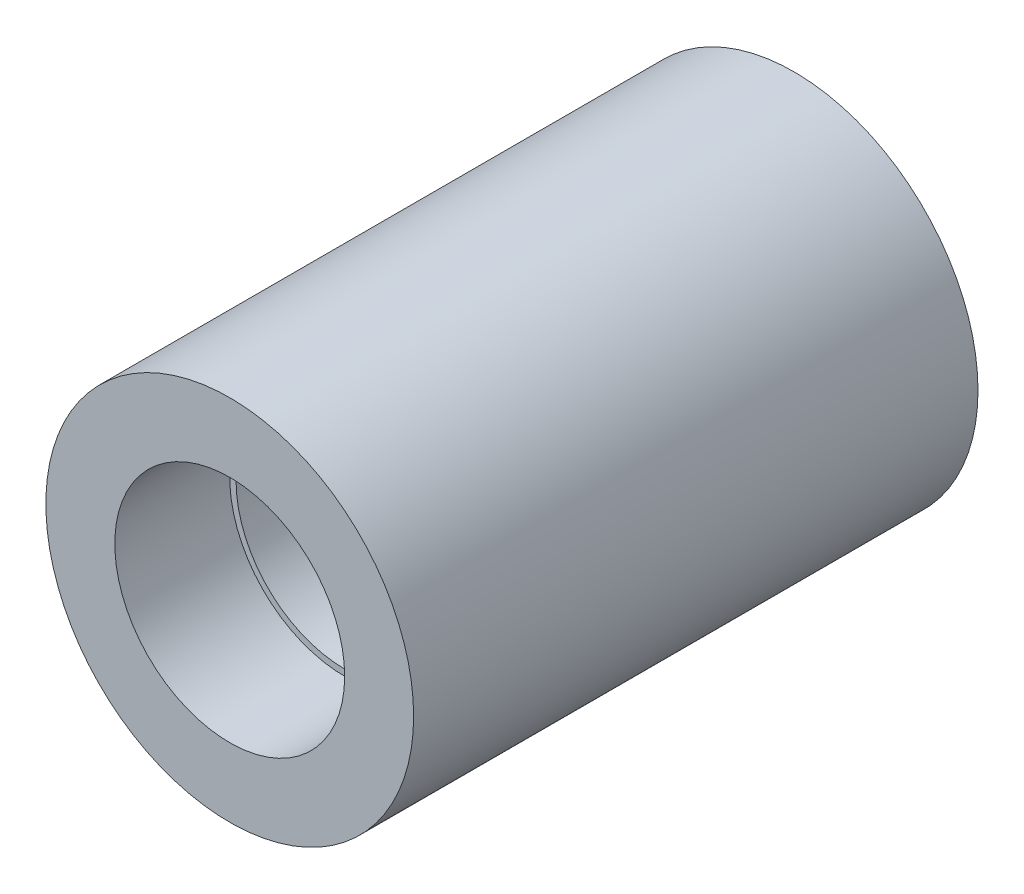
from build123d import *

# Parameters (mm, degrees)
SKETCH1_R           = 5.08
SKETCH1_R_2         = 3.175
BOSS_EXTRUDE1_DEPTH = 3.175
BOSS_EXTRUDE2_START = -12.41552
SKETCH1_3_R         = 5.08
SKETCH1_3_R_2       = 3
BOSS_EXTRUDE2_DEPTH = 12.41552


with BuildPart() as part:
    # Sketch1 → Boss-Extrude1 (new body)
    with BuildSketch(Plane.XY):
        Circle(SKETCH1_R)
        Circle(SKETCH1_R_2, mode=Mode.SUBTRACT)
    extrude(amount=BOSS_EXTRUDE1_DEPTH)

    # Sketch1<3> → Boss-Extrude2 (add)
    with BuildSketch(Plane.XY.offset(BOSS_EXTRUDE2_START)):
        Circle(SKETCH1_3_R)
        Circle(SKETCH1_3_R_2, mode=Mode.SUBTRACT)
    extrude(amount=BOSS_EXTRUDE2_DEPTH)


solid = part.part
